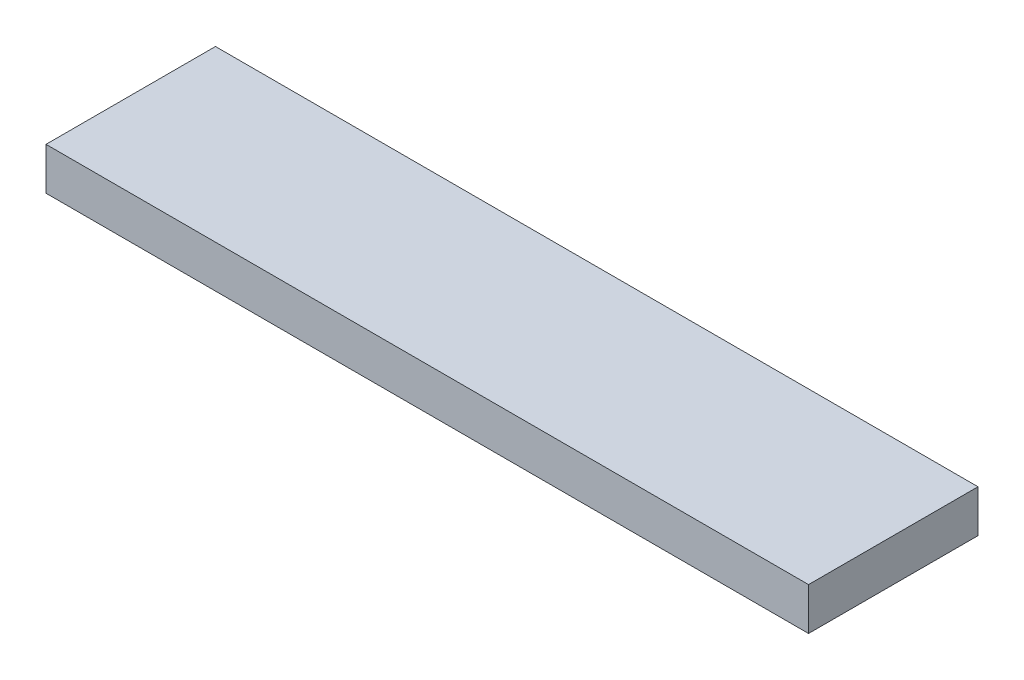
from build123d import *

# Parameters (mm, degrees)
BLOCKBASE_W = 228.6
BLOCKBASE_H = 12.7
BLOCK_DEPTH = 50.8


with BuildPart() as part:
    # BlockBase → Block (new body)
    with BuildSketch(Plane.XY):
        Rectangle(BLOCKBASE_W, BLOCKBASE_H)
    extrude(amount=BLOCK_DEPTH)


solid = part.part
